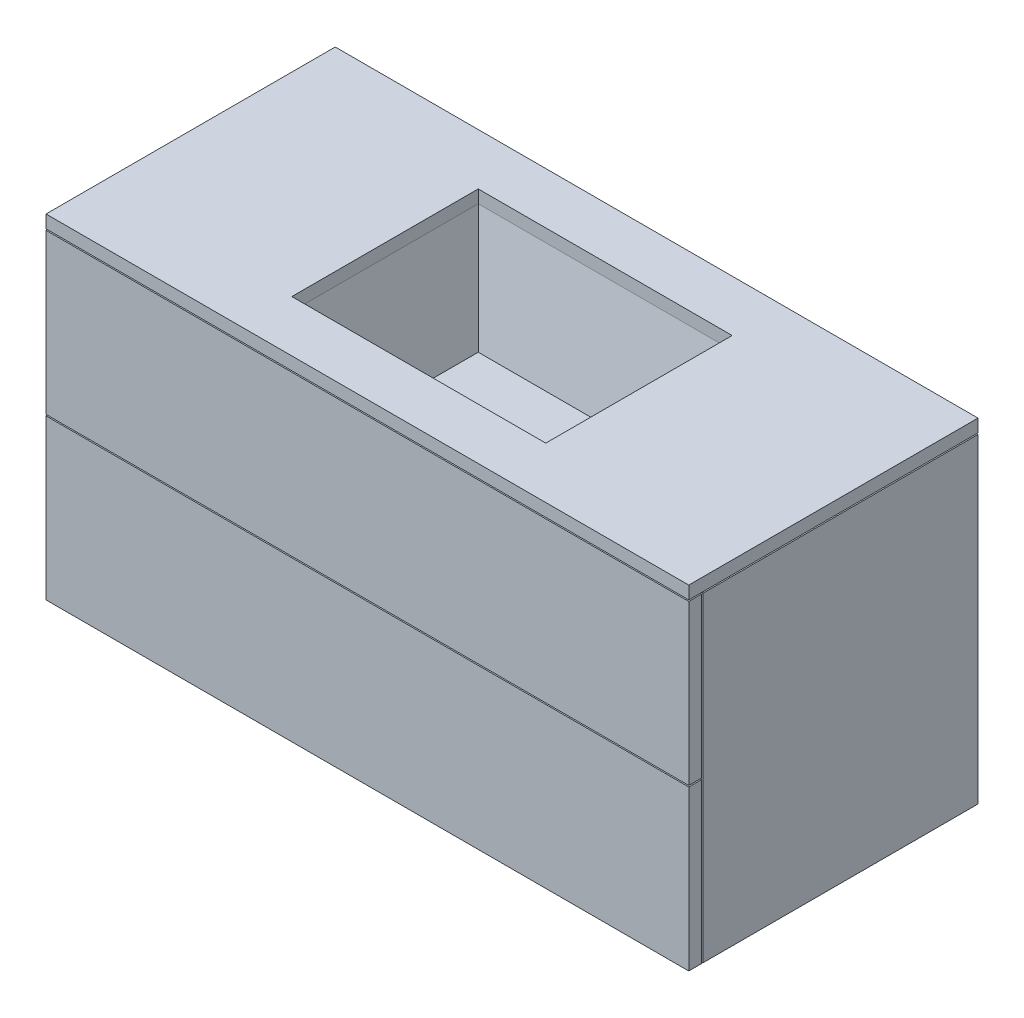
from build123d import *

# Parameters (mm, degrees)
SKETCH_1_W          = 1000
SKETCH_1_H          = 450
EXTRUDE_1_DEPTH     = 520
SKETCH_2_W          = 395
SKETCH_2_H          = 290
CUT_EXTRUDE_1_DEPTH = 20
SKETCH_8_W          = 1000
SKETCH_8_H          = 2
CUT_EXTRUDE_2_DEPTH = 20
CUT_EXTRUDE_3_DEPTH = 20


with BuildPart() as part:
    # Эскиз1 → Бобышка-Вытянуть1 (new body)
    with BuildSketch(Plane(origin=(0, 0, 0), x_dir=(1, 0, 0), z_dir=(0, 1, 0))):
        with Locations((500, 225)):
            Rectangle(SKETCH_1_W, SKETCH_1_H)
    extrude(amount=EXTRUDE_1_DEPTH)

    # Эскиз2 → Вырез-Вытянуть1 (cut)
    with BuildSketch(Plane(origin=(0, 520, 0), x_dir=(1, 0, 0), z_dir=(0, 1, 0))):
        with Locations((500, 225)):
            Rectangle(SKETCH_2_W, SKETCH_2_H)
    extrude(amount=-CUT_EXTRUDE_1_DEPTH, mode=Mode.SUBTRACT)

    # Эскиз3 → Вырез-По сечениям1 section 0
    with BuildSketch(Plane(origin=(0, 330, 0), x_dir=(1, 0, 0), z_dir=(0, 1, 0))):
        with BuildLine():
            Line((332.5, 340), (667.5, 340))
            Line((667.5, 340), (667.5, 110))
            Line((667.5, 110), (332.5, 110))
            Line((332.5, 110), (332.5, 340))
        make_face()
    # Эскиз4 → Вырез-По сечениям1 section 1
    with BuildSketch(Plane(origin=(0, 500, 0), x_dir=(1, 0, 0), z_dir=(0, 1, 0))):
        with BuildLine():
            Line((302.5, 370), (697.5, 370))
            Line((697.5, 370), (697.5, 80))
            Line((697.5, 80), (302.5, 80))
            Line((302.5, 80), (302.5, 370))
        make_face()
    loft(mode=Mode.SUBTRACT)

    # Эскиз8 → Вырез-Вытянуть2 (cut)
    with BuildSketch(Plane.XY):
        with Locations((500, 499)):
            Rectangle(SKETCH_8_W, SKETCH_8_H)
        with Locations((500, 249)):
            Rectangle(SKETCH_8_W, SKETCH_8_H)
    extrude(amount=-CUT_EXTRUDE_2_DEPTH, mode=Mode.SUBTRACT)

    # Эскиз9 → Вырез-Вытянуть3 (cut)
    with BuildSketch(Plane.ZY):
        Polygon((-20, 500), (-450, 500), (-450, 498), (-22, 498), (-22, 0), (-20, 0), (-20, 498), align=None)
    cut_extrude_3 = extrude(amount=-CUT_EXTRUDE_3_DEPTH, mode=Mode.SUBTRACT)

    # Зеркальное отражение1: Вырез-Вытянуть3 across plane
    add(cut_extrude_3.mirror(Plane.ZY.offset(-500)), mode=Mode.SUBTRACT)


solid = part.part
